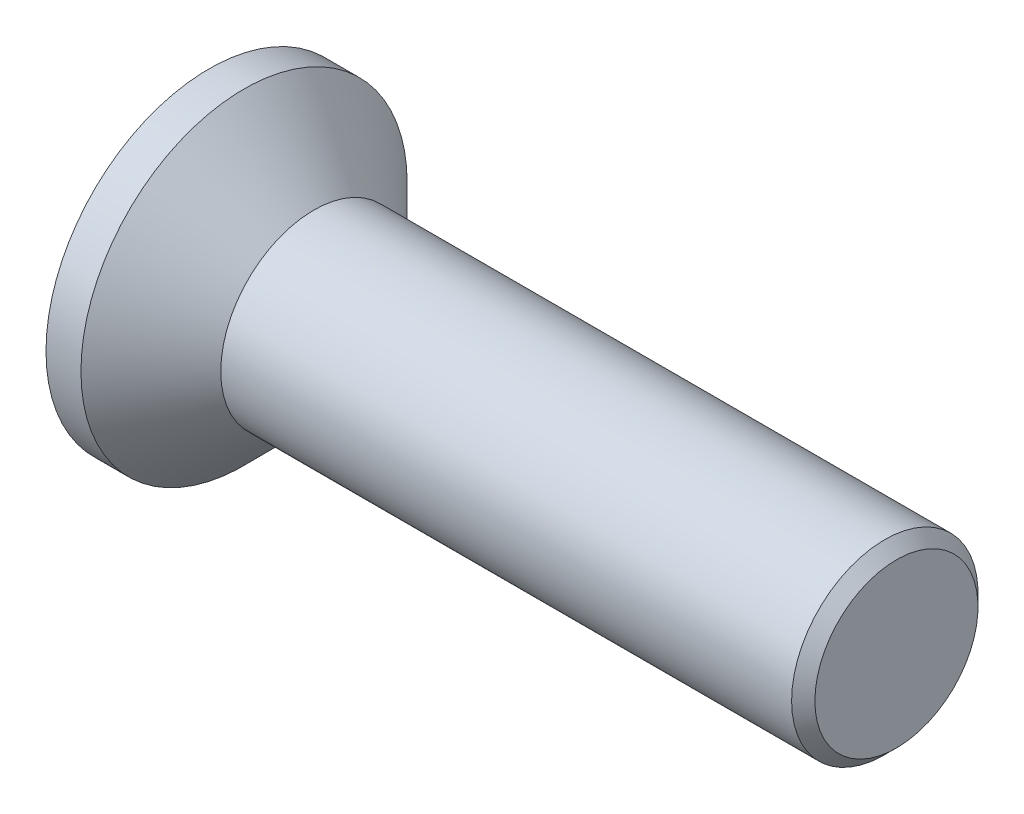
from build123d import *

# Parameters (mm, degrees)
CUT_EXTRUDE1_DEPTH = 3.5
CHAMFER1_SIZE      = 0.5


with BuildPart() as part:
    # Sketch1 → Revolve1 (revolve)
    with BuildSketch(Plane.XY, mode=Mode.PRIVATE) as revolve1_sk:
        Polygon((0, 0), (29.5, 0), (29.5, 4), (4.5, 4), (1.5, 7), (0, 7), align=None)
    revolve(revolve1_sk.sketch.rotate(Axis((0, 0, 0), (1, 0, 0)), 90), axis=Axis((0, 0, 0), (1, 0, 0)))

    # Sketch2 → Cut-Extrude1 (cut)
    with BuildSketch(Plane.ZY):
        Polygon((0, 2.886751346), (-2.5, 1.443375673), (-2.5, -1.443375673), (0, -2.886751346), (2.5, -1.443375673), (2.5, 1.443375673), align=None)
    extrude(amount=-CUT_EXTRUDE1_DEPTH, mode=Mode.SUBTRACT)

    # Chamfer1
    chamfer1_edges = [part.edges().sort_by_distance(p)[0] for p in [
        (29.5, 0, -4),
    ]]
    chamfer(chamfer1_edges, length=CHAMFER1_SIZE)


solid = part.part
